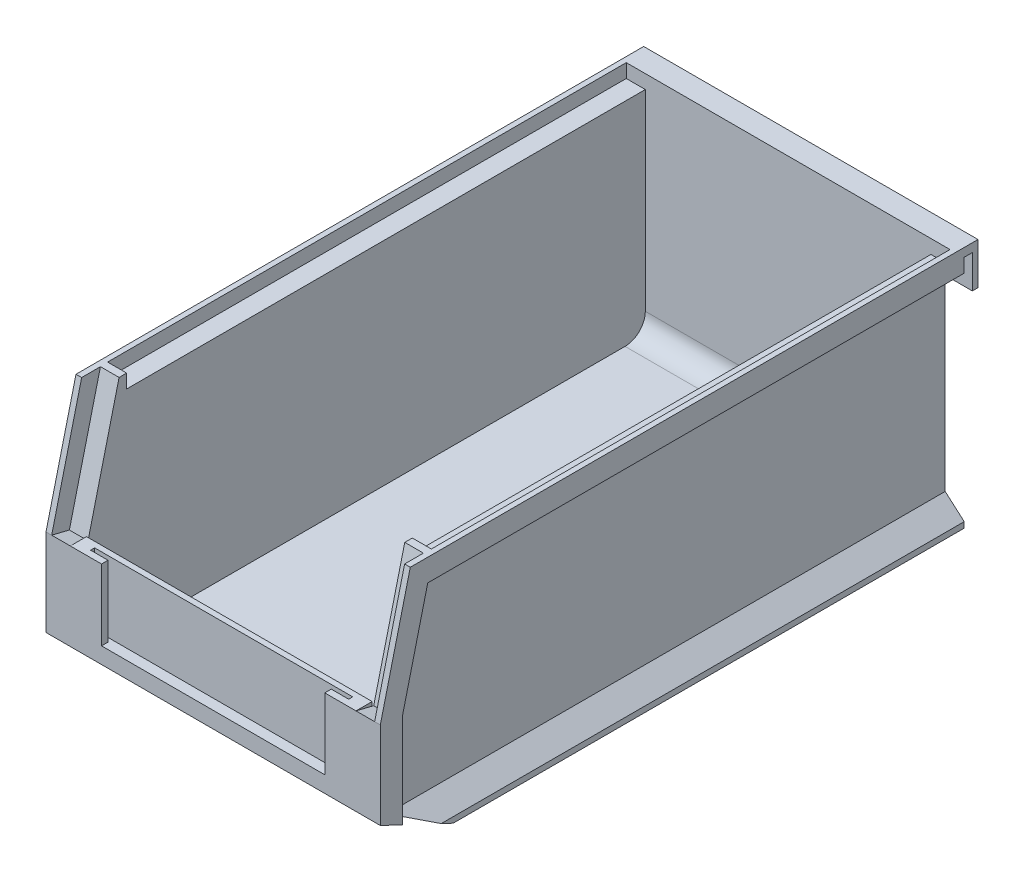
from build123d import *

# Parameters (mm, degrees)
SKETCH1_W                       = 104.775
SKETCH1_H                       = 76.2
BOSS_EXTRUDE1_DEPTH             = 187.325
CUT_EXTRUDE1_REACH              = 229.761
SKETCH3_W                       = 101.473
SKETCH3_H                       = 162.56
CUT_EXTRUDE2_DEPTH              = 4.318
SKETCH4_W                       = 89.535
SKETCH4_H                       = 175.133
CUT_EXTRUDE3_DEPTH              = 66.548
CUT_EXTRUDE3_DIRECTION_2_REACH  = 228.353
SKETCH5_W                       = 89.535
SKETCH5_H                       = 15.113
CUT_EXTRUDE4_DEPTH              = 38.1
CUT_EXTRUDE5_DEPTH              = 228.760611718
SKETCH7_W                       = 5.842
SKETCH7_H                       = 43.18
CUT_EXTRUDE6_DEPTH              = 5.715
CUT_EXTRUDE7_DEPTH              = 22.225
BOSS_EXTRUDE2_REACH             = 210.906
BOSS_EXTRUDE2_DIRECTION_2_REACH = 210.906
CUT_EXTRUDE8_DEPTH              = 104.775
CUT_EXTRUDE9_DEPTH              = 5.969
SKETCH12_W                      = 86.995
SKETCH12_H                      = 164.98932792
CUT_EXTRUDE10_DEPTH             = 2.921
CUT_EXTRUDE11_DEPTH             = 225.222663159
FILLET1_R                       = 6.35


with BuildPart() as part:
    # Sketch1 → Boss-Extrude1 (new body)
    with BuildSketch(Plane.XY):
        with Locations((52.3875, 38.1)):
            Rectangle(SKETCH1_W, SKETCH1_H)
    extrude(amount=BOSS_EXTRUDE1_DEPTH)

    # Sketch2 → Cut-Extrude1 (cut, up to next)
    with BuildSketch(Plane(origin=(104.775, 0, 0), x_dir=(0, 0, -1), z_dir=(1, 0, 0)), mode=Mode.PRIVATE) as cut_extrude1_sk1:
        Polygon((0, 0), (-4.318, 0), (-4.318, 73.533), (-1.778, 73.533), (-1.778, 63.119), (0, 63.119), align=None)
    cut_extrude1_tool1 = extrude(cut_extrude1_sk1.sketch, amount=-CUT_EXTRUDE1_REACH, mode=Mode.PRIVATE) & part.part
    add(cut_extrude1_tool1.solids().sort_by_distance((104.775, 34.812119, 2.237647))[0], mode=Mode.SUBTRACT)

    # Sketch3 → Cut-Extrude2 (cut)
    with BuildSketch(Plane(origin=(0, 76.2, 0), x_dir=(1, 0, 0), z_dir=(0, 1, 0))):
        with Locations((52.3875, -88.392)):
            Rectangle(SKETCH3_W, SKETCH3_H)
    extrude(amount=-CUT_EXTRUDE2_DEPTH, mode=Mode.SUBTRACT)

    # Sketch4 → Cut-Extrude3 (cut)
    with BuildSketch(Plane(origin=(0, 71.882, 0), x_dir=(1, 0, 0), z_dir=(0, 1, 0))):
        with Locations((52.3875, -94.6785)):
            Rectangle(SKETCH4_W, SKETCH4_H)
    extrude(amount=-CUT_EXTRUDE3_DEPTH, mode=Mode.SUBTRACT)

    # Sketch4 → Cut-Extrude3 direction 2 (cut, up to next)
    with BuildSketch(Plane(origin=(0, 71.882, 0), x_dir=(1, 0, 0), z_dir=(0, 1, 0)), mode=Mode.PRIVATE) as cut_extrude3_direction_2_sk1:
        with Locations((52.3875, -94.6785)):
            Rectangle(SKETCH4_W, SKETCH4_H)
    cut_extrude3_direction_2_tool1 = extrude(cut_extrude3_direction_2_sk1.sketch, amount=CUT_EXTRUDE3_DIRECTION_2_REACH, mode=Mode.PRIVATE) & part.part
    add(cut_extrude3_direction_2_tool1.solids().sort_by_distance((52.3875, 71.882, 94.6785))[0], mode=Mode.SUBTRACT)

    # Sketch5 → Cut-Extrude4 (cut)
    with BuildSketch(Plane(origin=(0, 76.2, 0), x_dir=(1, 0, 0), z_dir=(0, 1, 0))):
        with Locations((52.3875, -179.7685)):
            Rectangle(SKETCH5_W, SKETCH5_H)
    extrude(amount=-CUT_EXTRUDE4_DEPTH, mode=Mode.SUBTRACT)

    # Sketch6 → Cut-Extrude5 (cut, through all)
    with BuildSketch(Plane.ZY):
        Polygon((187.325, 38.1), (187.325, 76.2), (177.927, 76.2), align=None)
    extrude(amount=-CUT_EXTRUDE5_DEPTH, mode=Mode.SUBTRACT)

    # Sketch7 → Cut-Extrude6 (cut)
    with BuildSketch(Plane(origin=(0, 45.741868113, 185.440005865), x_dir=(1, 0, 0), z_dir=(0, 0.2394884713086026, 0.9708992080078492))):
        with Locations((4.699, 13.719081937)):
            Rectangle(SKETCH7_W, SKETCH7_H)
        with Locations((100.076, 13.719081937)):
            Rectangle(SKETCH7_W, SKETCH7_H)
    extrude(amount=-CUT_EXTRUDE6_DEPTH, mode=Mode.SUBTRACT)

    # Sketch8 → Cut-Extrude7 (cut)
    with BuildSketch(Plane(origin=(0, 38.1, 0), x_dir=(1, 0, 0), z_dir=(0, 1, 0))):
        Polygon((92.837, -184.023), (11.938, -184.023), (11.938, -185.293), (17.399, -185.293), (17.399, -187.325), (87.376, -187.325), (87.376, -185.293), (92.837, -185.293), align=None)
    extrude(amount=-CUT_EXTRUDE7_DEPTH, mode=Mode.SUBTRACT)

    # Boss-Extrude2: up to this face of the body (flat: up to its plane)
    boss_extrude2_end = Plane(part.part.faces().sort_by_distance((97.155, 38.338270724, 93.520892383))[0])
    # Sketch9 → Boss-Extrude2 (add, up to the picked face)
    with BuildSketch(Plane(origin=(52.3875, 0, 0), x_dir=(0, 0, -1), z_dir=(1, 0, 0)), mode=Mode.PRIVATE) as boss_extrude2_sk1:
        Polygon((-156.845, 5.334), (-182.245, 5.334), (-182.245, 27.448933333), align=None)
    boss_extrude2_tool1 = split(extrude(boss_extrude2_sk1.sketch, amount=BOSS_EXTRUDE2_REACH, mode=Mode.PRIVATE), bisect_by=boss_extrude2_end, keep=Keep.BOTH, mode=Mode.PRIVATE)
    add(boss_extrude2_tool1.solids().sort_by(Axis((52.3875, 12.705644, 173.778333), (1, 0, 0)))[0])

    # Boss-Extrude2 direction 2: up to this face of the body (flat: up to its plane)
    boss_extrude2_direction_2_end = Plane(part.part.faces().sort_by_distance((7.62, 38.338270724, 93.520892383))[0])
    # Sketch9 → Boss-Extrude2 direction 2 (add, up to the picked face)
    with BuildSketch(Plane(origin=(52.3875, 0, 0), x_dir=(0, 0, -1), z_dir=(1, 0, 0)), mode=Mode.PRIVATE) as boss_extrude2_direction_2_sk1:
        Polygon((-156.845, 5.334), (-182.245, 5.334), (-182.245, 27.448933333), align=None)
    boss_extrude2_direction_2_tool1 = split(extrude(boss_extrude2_direction_2_sk1.sketch, amount=-BOSS_EXTRUDE2_DIRECTION_2_REACH, mode=Mode.PRIVATE), bisect_by=boss_extrude2_direction_2_end, keep=Keep.BOTH, mode=Mode.PRIVATE)
    add(boss_extrude2_direction_2_tool1.solids().sort_by(Axis((52.3875, 12.705644, 173.778333), (-1, 0, 0)))[0])

    # Sketch10 → Cut-Extrude8 (cut)
    with BuildSketch(Plane(origin=(104.775, 0, 0), x_dir=(0, 0, -1), z_dir=(1, 0, 0))):
        Polygon((-187.325, 10.795), (-187.325, 0), (-164.465, 0), align=None)
    extrude(amount=-CUT_EXTRUDE8_DEPTH, mode=Mode.SUBTRACT)

    # Sketch11 → Cut-Extrude9 (cut)
    with BuildSketch(Plane.ZY):
        Polygon((110.611802523, 69.215), (4.318, 69.215), (4.318, 6.985), (180.34, 6.985), (180.34, 37.251236671), (172.455605046, 69.215), align=None)
    cut_extrude9 = extrude(amount=-CUT_EXTRUDE9_DEPTH, mode=Mode.SUBTRACT)

    # Mirror1: Cut-Extrude9 across plane
    add(cut_extrude9.mirror(Plane(origin=(52.3875, 0, 0), x_dir=(0, 0, 1), z_dir=(1, 0, 0))), mode=Mode.SUBTRACT)

    # Sketch12 → Cut-Extrude10 (cut)
    with BuildSketch(Plane.XZ):
        with Locations((52.3875, 86.81266396)):
            Rectangle(SKETCH12_W, SKETCH12_H)
    extrude(amount=-CUT_EXTRUDE10_DEPTH, mode=Mode.SUBTRACT)

    # Sketch13 → Cut-Extrude11 (cut, through all)
    with BuildSketch(Plane(origin=(0, 0, 4.318), x_dir=(-1, 0, 0), z_dir=(0, 0, -1))):
        Polygon((-5.969, 6.985), (0, 6.985), (0, 1.778), align=None)
        Polygon((-98.806, 6.985), (-104.775, 6.985), (-104.775, 1.778), align=None)
    extrude(amount=-CUT_EXTRUDE11_DEPTH, mode=Mode.SUBTRACT)

    # Fillet1
    fillet1_edges = [part.edges().sort_by_distance(p)[0] for p in [
        (52.3875, 5.334, 7.112),
        (52.3875, 5.334, 156.845),
    ]]
    fillet(fillet1_edges, radius=FILLET1_R)


solid = part.part
